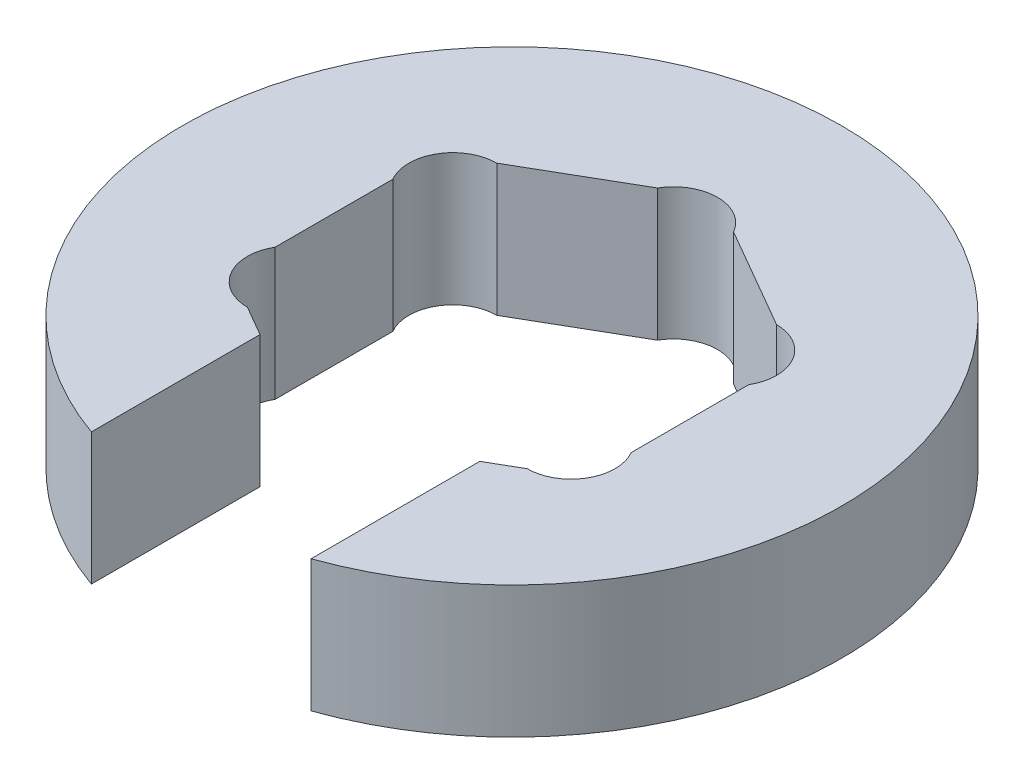
from build123d import *

# Parameters (mm, degrees)
SKETCH_3_R               = 7.5
EXTRUDE_2_DEPTH          = 3
CUT_EXTRUDE_1_DEPTH      = 5
SKETCH_5_R               = 1
CUT_EXTRUDE_2_DEPTH      = 5
PATTERN_CIRCULAR_1_COUNT = 6
CUT_EXTRUDE_3_DEPTH      = 10


with BuildPart() as part:
    # 스케치3 → 보스-돌출2 (new body)
    with BuildSketch(Plane(origin=(0, 0, 0), x_dir=(1, 0, 0), z_dir=(0, 1, 0))):
        with Locations(Location((0, 0, 0), (0, 0, 270))):
            Circle(SKETCH_3_R)
    extrude(amount=EXTRUDE_2_DEPTH)

    # 스케치4 → 컷-돌출1 (cut)
    with BuildSketch(Plane(origin=(0, 3, 0), x_dir=(1, 0, 0), z_dir=(0, 1, 0))):
        Polygon((4.05, 2.33826859), (0, 4.67653718), (-4.05, 2.33826859), (-4.05, -2.33826859), (0, -4.67653718), (4.05, -2.33826859), align=None)
    extrude(amount=-CUT_EXTRUDE_1_DEPTH, mode=Mode.SUBTRACT)

    # 스케치5 → 컷-돌출2 (cut)
    with BuildSketch(Plane(origin=(0, 3, 0), x_dir=(1, 0, 0), z_dir=(0, 1, 0))):
        with Locations((0, 3.67653718)):
            Circle(SKETCH_5_R)
    cut_extrude_2 = extrude(amount=-CUT_EXTRUDE_2_DEPTH, mode=Mode.SUBTRACT)

    # 원형 패턴1: 컷-돌출2 ×6 about axis
    pattern_circular_1_axis = Axis((0, 0, 0), (0, 1, 0))
    for i in range(1, PATTERN_CIRCULAR_1_COUNT):
        add(cut_extrude_2.rotate(pattern_circular_1_axis, i * 360 / PATTERN_CIRCULAR_1_COUNT), mode=Mode.SUBTRACT)

    # 스케치6 → 컷-돌출3 (cut)
    with BuildSketch(Plane(origin=(0, 3, 0), x_dir=(1, 0, 0), z_dir=(0, 1, 0))):
        with BuildLine():
            Line((-2.5, -8.065496872), (-2.5, -2.774670645))
            ThreePointArc((-2.5, -2.774670645), (0, -0.274670645), (2.5, -2.774670645))
            Line((2.5, -2.774670645), (2.5, -8.065496872))
            ThreePointArc((2.5, -8.065496872), (0, -10.565496872), (-2.5, -8.065496872))
        make_face()
    extrude(amount=-CUT_EXTRUDE_3_DEPTH, mode=Mode.SUBTRACT)


solid = part.part
